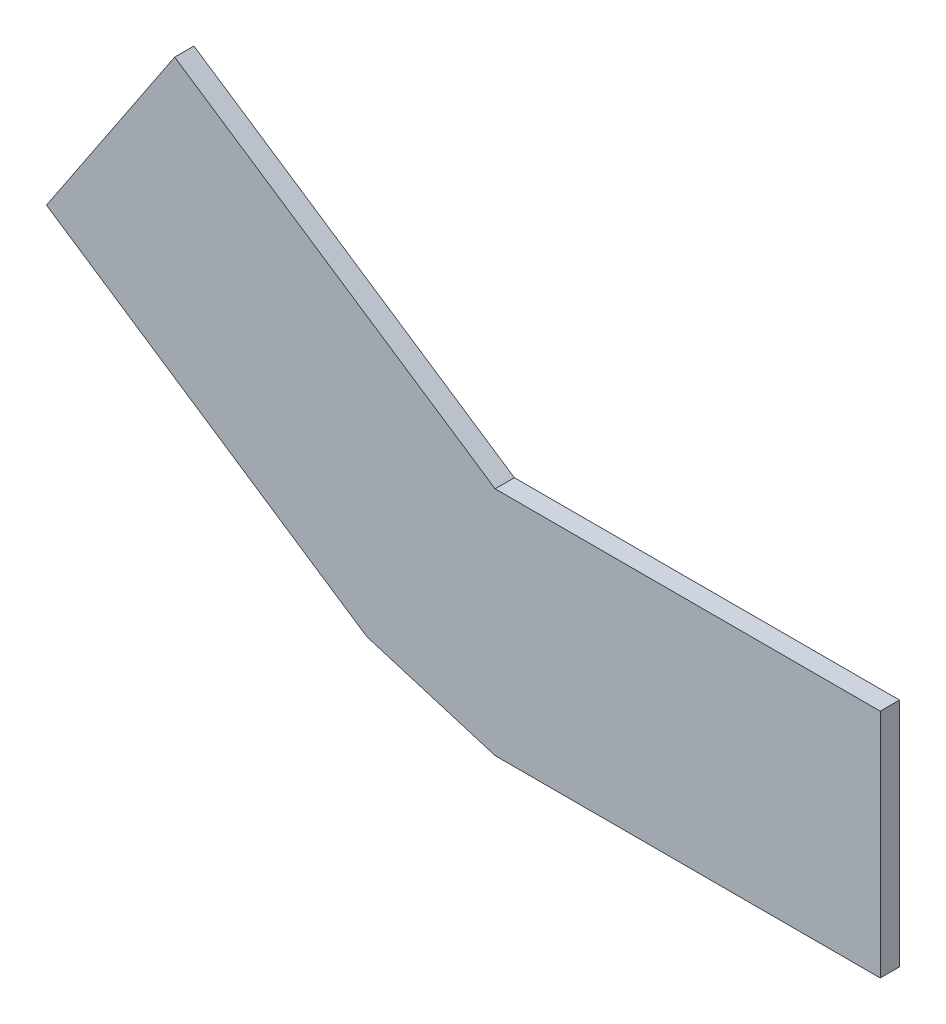
from build123d import *

# Parameters (mm, degrees)
BOSS_EXTRUDE4_DEPTH = 5


with BuildPart() as part:
    # Sketch1 → Boss-Extrude4 (new body)
    with BuildSketch(Plane.XY):
        Polygon((-482.733525219, 80.682413465), (-399.528495785, 25.212393843), (-299.528495785, 25.212393843), (-299.528495785, -34.787606157), (-399.528495785, -34.787606157), (-432.810507559, -24.710623817), (-516.015536993, 30.759395805), align=None)
    extrude(amount=BOSS_EXTRUDE4_DEPTH)


solid = part.part
